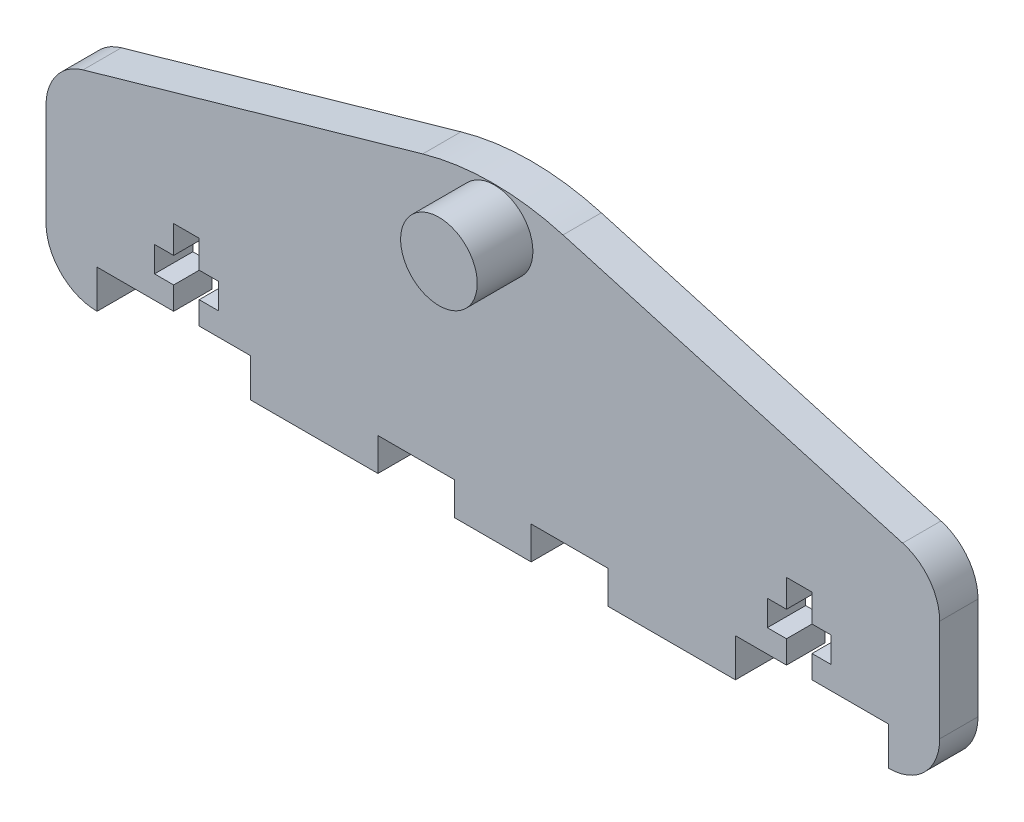
from build123d import *

# Parameters (mm, degrees)
ESQUISSE1_R             = 5
BOSS_EXTRU_1_DEPTH      = 15
ESQUISSE2_W             = 30
ESQUISSE2_H             = 12.881717487
ENL_V_MAT_EXTRU_1_DEPTH = 15
ESQUISSE3_W             = 20
ESQUISSE3_H             = 15
ENL_V_MAT_EXTRU_2_DEPTH = 15
ESQUISSE5_R             = 15
BOSS_EXTRU_2_DEPTH      = 21.8


with BuildPart() as part:
    # Esquisse1 → Boss.-Extru.1 (new body)
    with BuildSketch(Plane.XY):
        with BuildLine():
            Line((-160.494422558, 41.644450698), (-27.47211279, 79.650824917))
            ThreePointArc((-27.47211279, 79.650824917), (0, 83.498430153), (27.47211279, 79.650824917))
            Line((27.47211279, 79.650824917), (160.494422558, 41.644450698))
            ThreePointArc((160.494422558, 41.644450698), (170.966972962, 34.457882008), (175, 22.413971745))
            Line((175, 22.413971745), (175, -17.5))
            ThreePointArc((175, -17.5), (169.142135624, -31.642135624), (155, -37.5))
            Line((155, -37.5), (-155, -37.5))
            ThreePointArc((-155, -37.5), (-169.142135624, -31.642135624), (-175, -17.5))
            Line((-175, -17.5), (-175, 22.413971745))
            ThreePointArc((-175, 22.413971745), (-170.966972962, 34.457882008), (-160.494422558, 41.644450698))
        make_face()
        with Locations((0, 68.16509682)):
            Circle(ESQUISSE1_R, mode=Mode.SUBTRACT)
    extrude(amount=BOSS_EXTRU_1_DEPTH)

    # Esquisse2 → Enlèv. mat.-Extru.1 (cut)
    with BuildSketch(Plane.XY.offset(15)):
        Polygon((95, -37.5), (115, -37.5), (125, -37.5), (135, -37.5), (135, -22.5), (125, -22.5), (125, -13.549697849), (132.5, -13.549697849), (132.5, -3.549697849), (125, -3.549697849), (125, 7.276030806), (115, 7.276030806), (115, -3.549697849), (107.5, -3.549697849), (107.5, -13.549697849), (115, -13.549697849), (115, -22.5), (95, -22.5), align=None)
        with Locations((30, -31.059141256)):
            Rectangle(ESQUISSE2_W, ESQUISSE2_H)
        with Locations((-30, -31.059141256)):
            Rectangle(ESQUISSE2_W, ESQUISSE2_H)
        Polygon((-115, -37.5), (-95, -37.5), (-95, -22.5), (-115, -22.5), (-115, -13.549697849), (-107.5, -13.549697849), (-107.5, -3.549697849), (-115, -3.549697849), (-115, 7.276030806), (-125, 7.276030806), (-125, -3.549697849), (-132.5, -3.549697849), (-132.5, -13.549697849), (-125, -13.549697849), (-125, -22.5), (-135, -22.5), (-135, -37.5), (-125, -37.5), align=None)
    extrude(amount=-ENL_V_MAT_EXTRU_1_DEPTH, mode=Mode.SUBTRACT)

    # Esquisse3 → Enlèv. mat.-Extru.2 (cut)
    with BuildSketch(Plane(origin=(0, 0, 0), x_dir=(-1, 0, 0), z_dir=(0, 0, -1))):
        with Locations((145, -30)):
            Rectangle(ESQUISSE3_W, ESQUISSE3_H)
        with Locations((-145, -30)):
            Rectangle(ESQUISSE3_W, ESQUISSE3_H)
    extrude(amount=-ENL_V_MAT_EXTRU_2_DEPTH, mode=Mode.SUBTRACT)

    # Esquisse5 → Boss.-Extru.2 (add)
    with BuildSketch(Plane.XY.offset(15)):
        with Locations((0.685853551, 68.16509682)):
            Circle(ESQUISSE5_R)
    extrude(amount=BOSS_EXTRU_2_DEPTH)


solid = part.part
